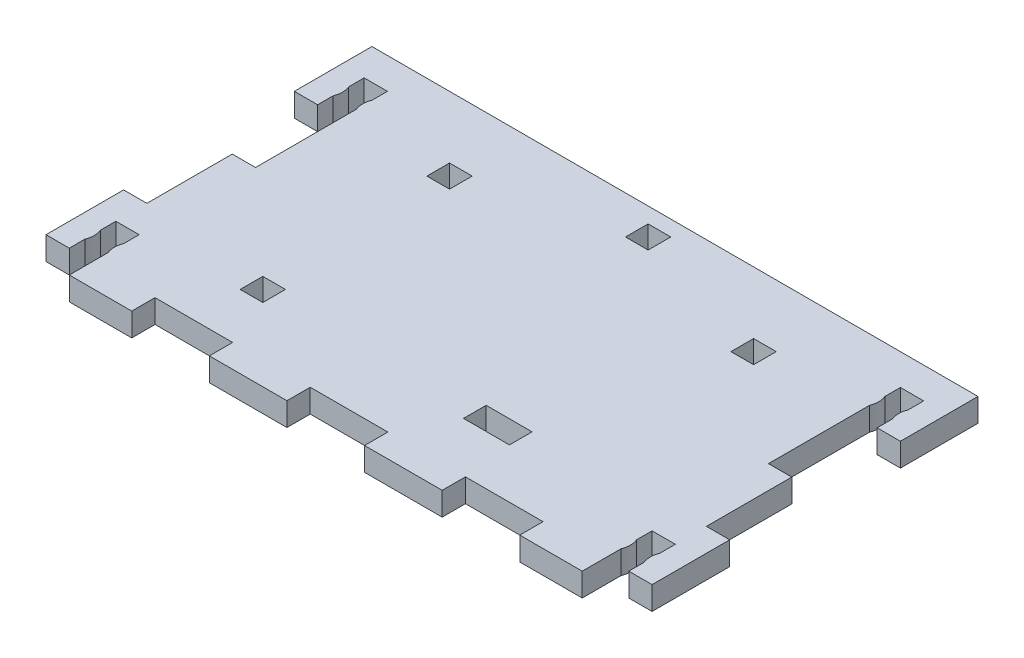
from build123d import *

# Parameters (mm, degrees)
SKETCH1_W           = 2.92
SKETCH1_H           = 2.92
SKETCH1_W_2         = 5.92
BOSS_EXTRUDE1_DEPTH = 3


with BuildPart() as part:
    # Sketch1 → Boss-Extrude1 (new body)
    with BuildSketch(Plane(origin=(0, 0, 0), x_dir=(1, 0, 0), z_dir=(0, 1, 0))):
        with BuildLine():
            Line((-37.489699571, 19.876646482), (-37.489699571, 9.876646482))
            Line((-37.489699571, 9.876646482), (-34.489699571, 9.876646482))
            Line((-34.489699571, 9.876646482), (-34.489699571, 11.876646482))
            ThreePointArc((-34.489699571, 11.876646482), (-34.289699571, 12.876646482), (-34.489699571, 13.876646482))
            Line((-34.489699571, 13.876646482), (-34.489699571, 15.876646482))
            Line((-34.489699571, 15.876646482), (-31.489699571, 15.876646482))
            Line((-31.489699571, 15.876646482), (-31.489699571, 13.876646482))
            ThreePointArc((-31.489699571, 13.876646482), (-31.689699571, 12.876646482), (-31.489699571, 11.876646482))
            Line((-31.489699571, 11.876646482), (-31.489699571, -1.123353518))
            Line((-31.489699571, -1.123353518), (-34.489699571, -1.123353518))
            Line((-34.489699571, -1.123353518), (-34.489699571, -12.123353518))
            Line((-34.489699571, -12.123353518), (-37.489699571, -12.123353518))
            Line((-37.489699571, -12.123353518), (-37.489699571, -22.123353518))
            Line((-37.489699571, -22.123353518), (-34.489699571, -22.123353518))
            Line((-34.489699571, -22.123353518), (-34.489699571, -20.123353518))
            ThreePointArc((-34.489699571, -20.123353518), (-34.289699571, -19.123353518), (-34.489699571, -18.123353518))
            Line((-34.489699571, -18.123353518), (-34.489699571, -16.123353518))
            Line((-34.489699571, -16.123353518), (-31.489699571, -16.123353518))
            Line((-31.489699571, -16.123353518), (-31.489699571, -18.123353518))
            ThreePointArc((-31.489699571, -18.123353518), (-31.689699571, -19.123353518), (-31.489699571, -20.123353518))
            Line((-31.489699571, -20.123353518), (-31.489699571, -25.123353518))
            Line((-31.489699571, -25.123353518), (-23.439699571, -25.123353518))
            Line((-23.439699571, -25.123353518), (-23.439699571, -22.123353518))
            Line((-23.439699571, -22.123353518), (-13.439699571, -22.123353518))
            Line((-13.439699571, -22.123353518), (-13.439699571, -25.123353518))
            Line((-13.439699571, -25.123353518), (-3.439699571, -25.123353518))
            Line((-3.439699571, -25.123353518), (-3.439699571, -22.123353518))
            Line((-3.439699571, -22.123353518), (6.560300429, -22.123353518))
            Line((6.560300429, -22.123353518), (6.560300429, -25.123353518))
            Line((6.560300429, -25.123353518), (16.560300429, -25.123353518))
            Line((16.560300429, -25.123353518), (16.560300429, -22.123353518))
            Line((16.560300429, -22.123353518), (26.560300429, -22.123353518))
            Line((26.560300429, -22.123353518), (26.560300429, -25.123353518))
            Line((26.560300429, -25.123353518), (34.610300429, -25.123353518))
            Line((34.610300429, -25.123353518), (34.610300429, -20.123353518))
            ThreePointArc((34.610300429, -20.123353518), (34.810300429, -19.123353518), (34.610300429, -18.123353518))
            Line((34.610300429, -18.123353518), (34.610300429, -16.123353518))
            Line((34.610300429, -16.123353518), (37.610300429, -16.123353518))
            Line((37.610300429, -16.123353518), (37.610300429, -18.123353518))
            ThreePointArc((37.610300429, -18.123353518), (37.410300429, -19.123353518), (37.610300429, -20.123353518))
            Line((37.610300429, -20.123353518), (37.610300429, -22.123353518))
            Line((37.610300429, -22.123353518), (40.610300429, -22.123353518))
            Line((40.610300429, -22.123353518), (40.610300429, -12.123353518))
            Line((40.610300429, -12.123353518), (37.610300429, -12.123353518))
            Line((37.610300429, -12.123353518), (37.610300429, -1.123353518))
            Line((37.610300429, -1.123353518), (34.610300429, -1.123353518))
            Line((34.610300429, -1.123353518), (34.610300429, 11.876646482))
            ThreePointArc((34.610300429, 11.876646482), (34.810300429, 12.876646482), (34.610300429, 13.876646482))
            Line((34.610300429, 13.876646482), (34.610300429, 15.876646482))
            Line((34.610300429, 15.876646482), (37.610300429, 15.876646482))
            Line((37.610300429, 15.876646482), (37.610300429, 13.876646482))
            ThreePointArc((37.610300429, 13.876646482), (37.410300429, 12.876646482), (37.610300429, 11.876646482))
            Line((37.610300429, 11.876646482), (37.610300429, 9.876646482))
            Line((37.610300429, 9.876646482), (40.610300429, 9.876646482))
            Line((40.610300429, 9.876646482), (40.610300429, 19.876646482))
            Line((40.610300429, 19.876646482), (-37.489699571, 19.876646482))
        make_face()
        with Locations((1.560300429, 16.416646482)):
            Rectangle(SKETCH1_W, SKETCH1_H, mode=Mode.SUBTRACT)
        with Locations((12.870300429, -14.263353518)):
            Rectangle(SKETCH1_W_2, SKETCH1_H, mode=Mode.SUBTRACT)
        with Locations((21.150300429, 10.416646482)):
            Rectangle(SKETCH1_W, SKETCH1_H, mode=Mode.SUBTRACT)
        with Locations((-18.029699571, 10.416646482)):
            Rectangle(SKETCH1_W, SKETCH1_H, mode=Mode.SUBTRACT)
        with Locations((-17.409699571, -14.263353518)):
            Rectangle(SKETCH1_W, SKETCH1_H, mode=Mode.SUBTRACT)
    extrude(amount=BOSS_EXTRUDE1_DEPTH)


solid = part.part
